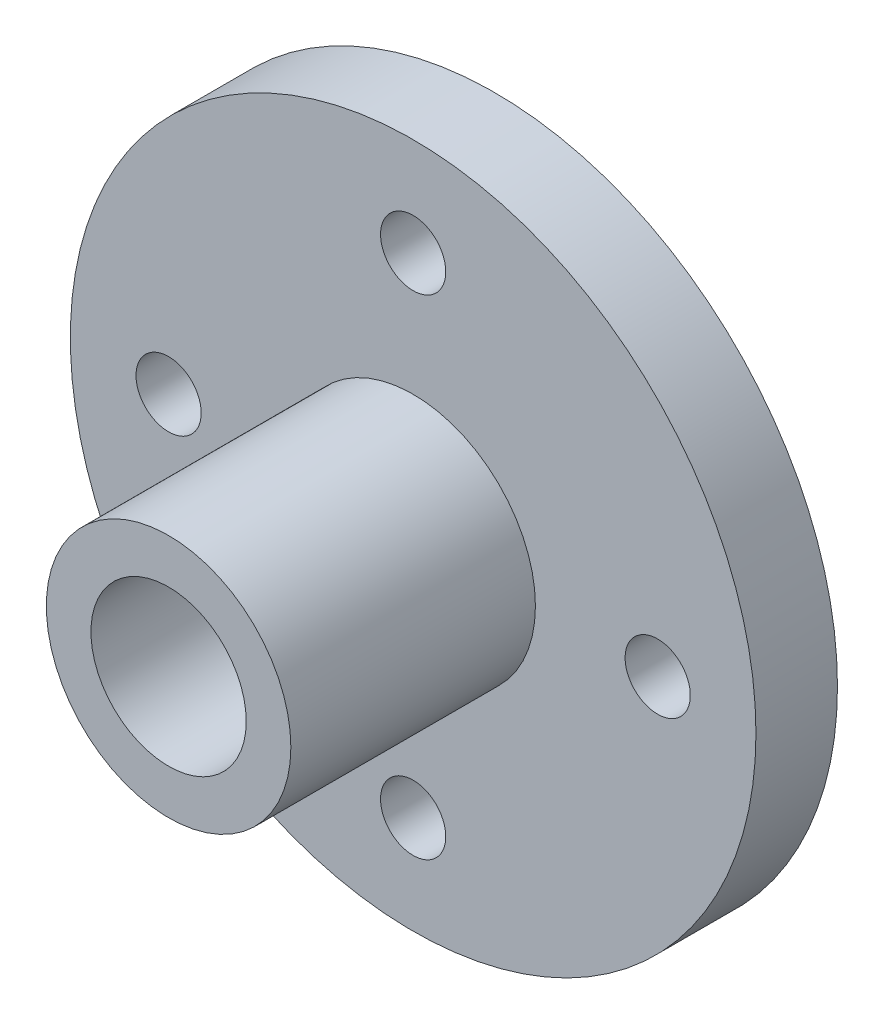
from build123d import *

# Parameters (mm, degrees)
SKETCH1_R           = 42.055
SKETCH1_R_2         = 9.525
SKETCH1_R_3         = 4
BOSS_EXTRUDE1_DEPTH = 5
SKETCH2_R           = 15
BOSS_EXTRUDE2_DEPTH = 30
SKETCH3_R           = 9.525
CUT_EXTRUDE1_DEPTH  = 72.674584408


with BuildPart() as part:
    # Sketch1 → Boss-Extrude1 (new, symmetric)
    with BuildSketch(Plane.XY):
        Circle(SKETCH1_R)
        Circle(SKETCH1_R_2, mode=Mode.SUBTRACT)
        with Locations((0, 30)):
            Circle(SKETCH1_R_3, mode=Mode.SUBTRACT)
        with Locations((-30, 0)):
            Circle(SKETCH1_R_3, mode=Mode.SUBTRACT)
        with Locations(Location((0, -30, 0), (0, 0, 180))):
            Circle(SKETCH1_R_3, mode=Mode.SUBTRACT)
        with Locations(Location((30, 0, 0), (0, 0, 180))):
            Circle(SKETCH1_R_3, mode=Mode.SUBTRACT)
    extrude(amount=BOSS_EXTRUDE1_DEPTH, both=True)

    # Sketch2 → Boss-Extrude2 (add)
    with BuildSketch(Plane.XY.offset(5)):
        Circle(SKETCH2_R)
    extrude(amount=BOSS_EXTRUDE2_DEPTH)

    # Sketch3 → Cut-Extrude1 (cut, through all)
    with BuildSketch(Plane.XY.offset(35)):
        Circle(SKETCH3_R)
    extrude(amount=-CUT_EXTRUDE1_DEPTH, mode=Mode.SUBTRACT)


solid = part.part
